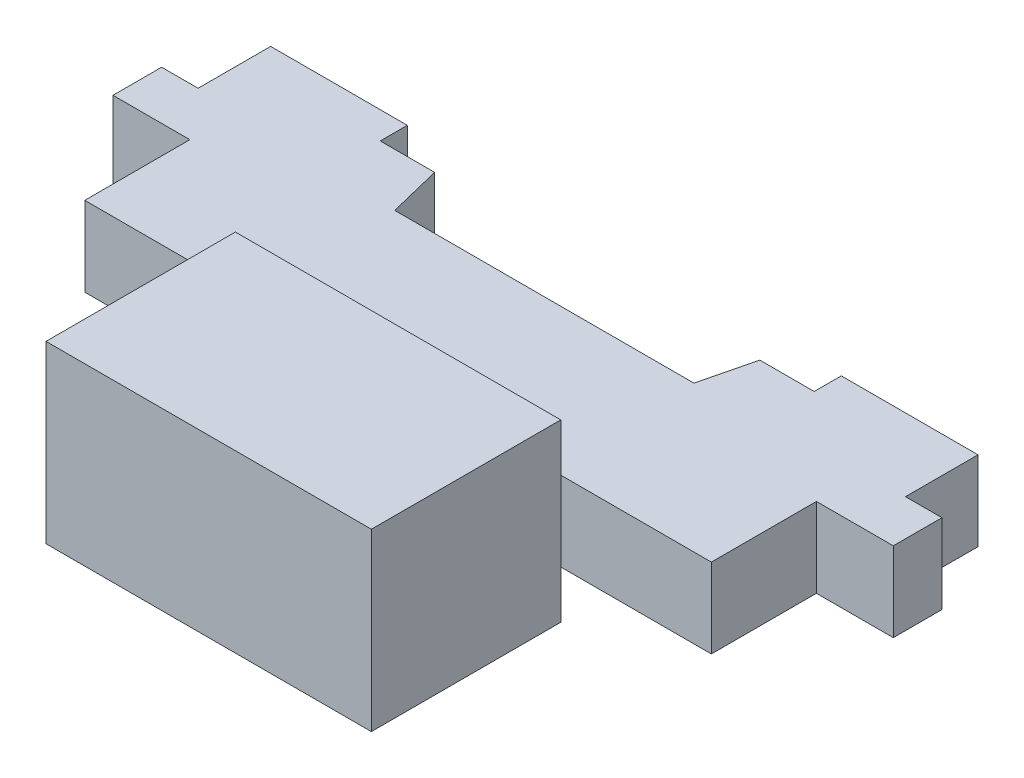
from build123d import *

# Parameters (mm, degrees)
BOSS_EXTRUDE1_DEPTH = 5.0165
SKETCH2_W           = 41.021
SKETCH2_H           = 23.876
BOSS_EXTRUDE2_DEPTH = 11.049


with BuildPart() as part:
    # Sketch1 → Boss-Extrude1 (new, symmetric)
    with BuildSketch(Plane(origin=(0, 0, 0), x_dir=(1, 0, 0), z_dir=(0, 1, 0))):
        Polygon((-18.8595, 0), (18.8595, 0), (20.4978, 6.6675), (27.3558, 6.6675), (27.3558, 10.0838), (44.5897, 10.0838), (44.5897, 0.9398), (49.1871, 0.9398), (49.1871, -5.1943), (39.497, -5.1943), (39.497, -18.4404), (-39.497, -18.4404), (-39.497, -5.1943), (-49.1871, -5.1943), (-49.1871, 0.9398), (-44.5897, 0.9398), (-44.5897, 10.0838), (-27.3558, 10.0838), (-27.3558, 6.6675), (-20.4978, 6.6675), align=None)
    extrude(amount=BOSS_EXTRUDE1_DEPTH, both=True)

    # Sketch2 → Boss-Extrude2 (add, symmetric)
    with BuildSketch(Plane(origin=(0, 0, 0), x_dir=(1, 0, 0), z_dir=(0, 1, 0))):
        with Locations((0, -30.3784)):
            Rectangle(SKETCH2_W, SKETCH2_H)
    extrude(amount=BOSS_EXTRUDE2_DEPTH, both=True)


solid = part.part
